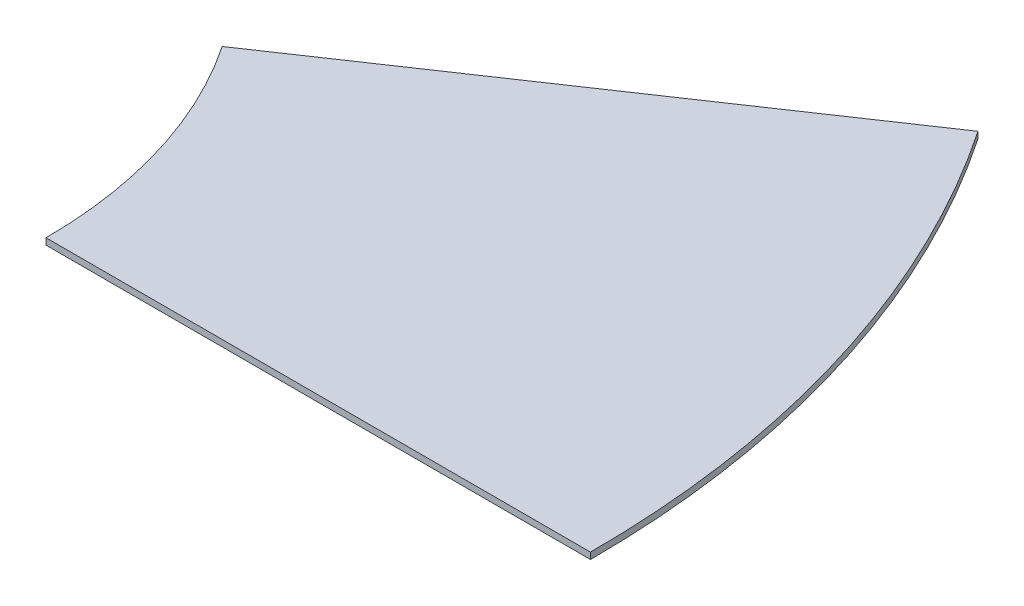
from build123d import *

# Parameters (mm, degrees)
EXTRUDE_1_DEPTH = 0.71


with BuildPart() as part:
    # 草图1 → 凸台-拉伸1 (new body)
    with BuildSketch(Plane(origin=(0, 0, 0), x_dir=(1, 0, 0), z_dir=(0, 1, 0))):
        with BuildLine():
            Line((91.194132981, 61.511219382), (41.451878628, 27.959645174))
            ThreePointArc((41.451878628, 27.959645174), (47.815237798, 14.618585236), (50, 0))
            Line((50, 0), (110, 0))
            ThreePointArc((110, 0), (105.193523156, 32.16088752), (91.194132981, 61.511219382))
        make_face()
    extrude(amount=EXTRUDE_1_DEPTH)


solid = part.part
